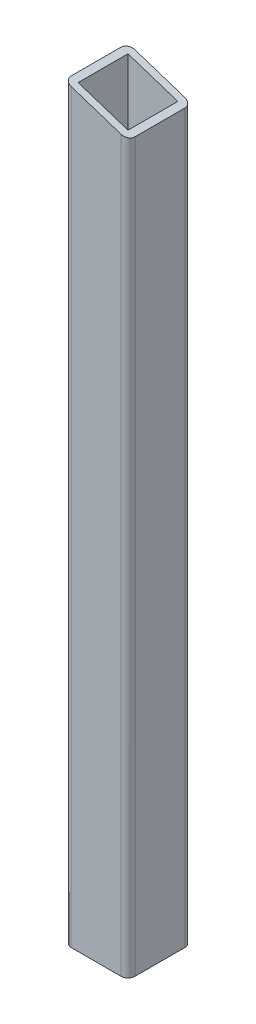
from build123d import *

# Parameters (mm, degrees)
BOSS_EXTRUDE1_DEPTH     = 300.25
SKETCH3_W               = 20
SKETCH3_H               = 20
CUT_EXTRUDE1_DEPTH      = 1040.5
CUT_EXTRUDE2_DEPTH      = 303.20069904
CUT_EXTRUDE2_DEPTH_BACK = 303.20069904


with BuildPart() as part:
    # Sketch1 → Boss-Extrude1 (new body)
    with BuildSketch(Plane(origin=(0, 0, 0), x_dir=(1, 0, 0), z_dir=(0, 1, 0))):
        with BuildLine():
            Line((2.8, 0), (22.8, 0))
            ThreePointArc((22.8, 0), (24.779898987, -0.820101013), (25.6, -2.8))
            Line((25.6, -2.8), (25.6, -22.8))
            ThreePointArc((25.6, -22.8), (24.779898987, -24.779898987), (22.8, -25.6))
            Line((22.8, -25.6), (2.8, -25.6))
            ThreePointArc((2.8, -25.6), (0.820101013, -24.779898987), (0, -22.8))
            Line((0, -22.8), (0, -2.8))
            ThreePointArc((0, -2.8), (0.820101013, -0.820101013), (2.8, 0))
        make_face()
    extrude(amount=BOSS_EXTRUDE1_DEPTH)

    # Sketch3 → Cut-Extrude1 (cut)
    with BuildSketch(Plane(origin=(0, 0, 0), x_dir=(-1, 0, 0), z_dir=(0, -1, 0))):
        with Locations((-12.8, -12.8)):
            Rectangle(SKETCH3_W, SKETCH3_H)
    extrude(amount=-CUT_EXTRUDE1_DEPTH, mode=Mode.SUBTRACT)

    # Sketch4 → Cut-Extrude2 (cut, two sides: drawn at the far end of the back side and taken through both)
    with BuildSketch(Plane.XY.offset(22.8).offset(-CUT_EXTRUDE2_DEPTH_BACK)):
        Polygon((-582.227773903, 491.001368364), (0, 300.25), (25.6, 291.862844236), (607.827773903, 101.111475872), (989.330510631, 1265.567023678), (-200.725037175, 1655.456916171), align=None)
    extrude(amount=CUT_EXTRUDE2_DEPTH + CUT_EXTRUDE2_DEPTH_BACK, mode=Mode.SUBTRACT)


solid = part.part
